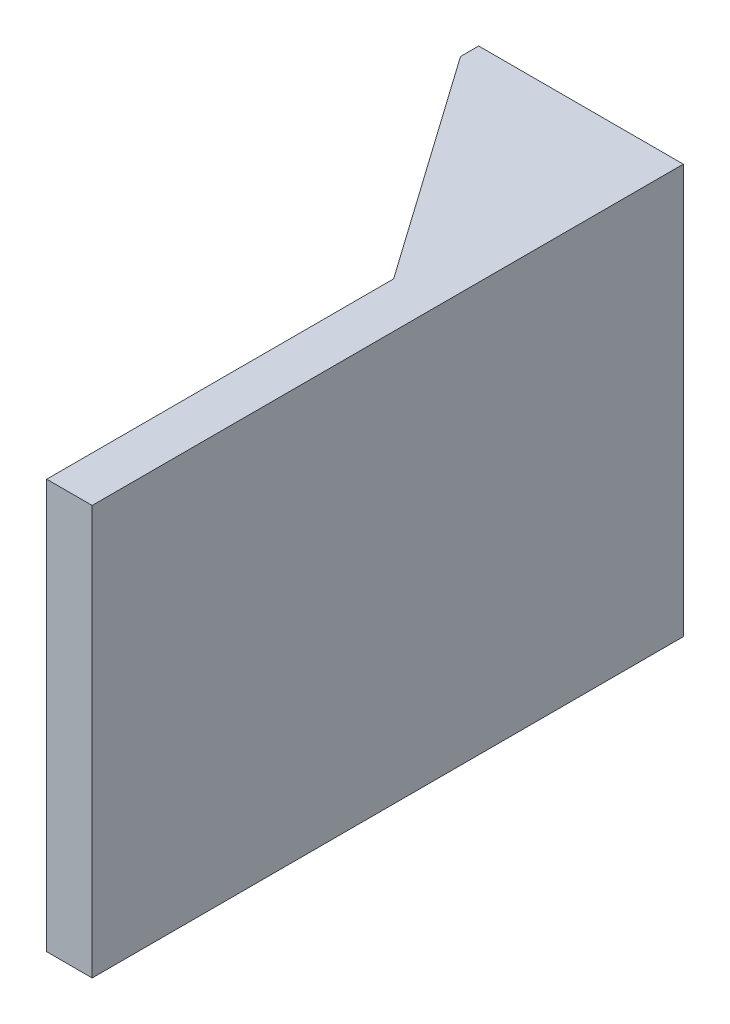
from build123d import *

# Parameters (mm, degrees)
BOSS_EXTRUDE1_DEPTH = 5
BOSS_EXTRUDE2_DEPTH = 40


with BuildPart() as part:
    # Sketch1 → Boss-Extrude1 (new body)
    with BuildSketch(Plane(origin=(0, 0, 0), x_dir=(1, 0, 0), z_dir=(0, 1, 0))):
        Polygon((15.55671577, -31.935616946), (15.55671577, 33.064383054), (-6.94328423, 33.064383054), (-6.94328423, 31.064383054), (10.55671577, 6.210249778), (10.55671577, -31.935616946), align=None)
    extrude(amount=BOSS_EXTRUDE1_DEPTH)

    # Sketch1<3> → Boss-Extrude2 (add)
    with BuildSketch(Plane(origin=(0, 0, 0), x_dir=(1, 0, 0), z_dir=(0, 1, 0))):
        Polygon((15.55671577, -31.935616946), (15.55671577, 33.064383054), (-6.94328423, 33.064383054), (-6.94328423, 31.064383054), (10.55671577, 31.064383054), (10.55671577, 6.210249778), (10.55671577, -31.935616946), align=None)
    extrude(amount=-BOSS_EXTRUDE2_DEPTH)


solid = part.part
